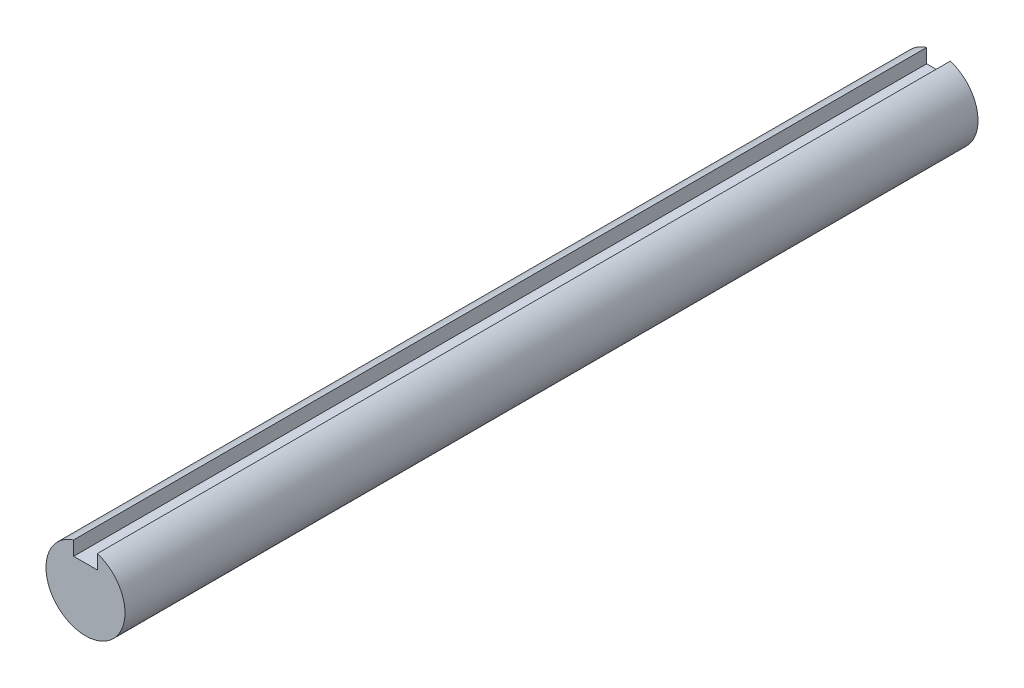
from build123d import *

# Parameters (mm, degrees)
BOSS_EXTRUDE1_DEPTH      = 53.975
BOSS_EXTRUDE1_DEPTH_BACK = 53.975


with BuildPart() as part:
    # Sketch3 → Boss-Extrude1 (new, two sides: drawn at the far end of the back side and taken through both)
    with BuildSketch(Plane.XY.offset(-BOSS_EXTRUDE1_DEPTH_BACK)):
        with BuildLine():
            Line((-1.5, 2.969696007), (-1.5, 4.769696007))
            ThreePointArc((-1.5, 4.769696007), (0, -5), (1.5, 4.769696007))
            Line((1.5, 4.769696007), (1.5, 2.969696007))
            Line((1.5, 2.969696007), (-1.5, 2.969696007))
        make_face()
    extrude(amount=BOSS_EXTRUDE1_DEPTH + BOSS_EXTRUDE1_DEPTH_BACK)


solid = part.part
